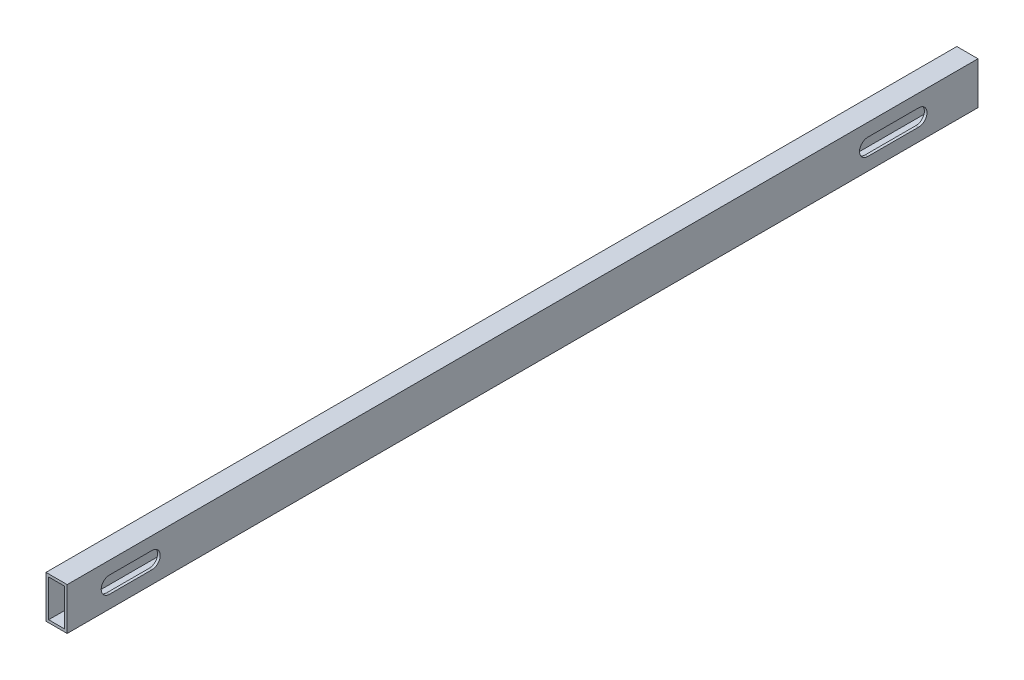
from build123d import *

# Parameters (mm, degrees)
SKETCH1_W           = 12.7
SKETCH1_H           = 25.4
SKETCH1_W_2         = 9.525
SKETCH1_H_2         = 22.225
BOSS_EXTRUDE1_DEPTH = 546.1
SKETCH2_R           = 3.81
SKETCH2_R_2         = 2.75
CUT_EXTRUDE1_DEPTH  = 547.395269013
CUT_EXTRUDE3_REACH  = 548.395
CUT_EXTRUDE5_REACH  = 548.727
SKETCH5_R           = 2.75


with BuildPart() as part:
    # Sketch1 → Boss-Extrude1 (new body)
    with BuildSketch(Plane.XY):
        Rectangle(SKETCH1_W, SKETCH1_H)
        Rectangle(SKETCH1_W_2, SKETCH1_H_2, mode=Mode.SUBTRACT)
    extrude(amount=BOSS_EXTRUDE1_DEPTH)

    # Sketch2 → Cut-Extrude1 (cut, through all)
    with BuildSketch(Plane(origin=(6.35, 0, 0), x_dir=(0, 0, -1), z_dir=(1, 0, 0))):
        with Locations((-508, 0)):
            Circle(SKETCH2_R)
        with Locations((-520.7, 0)):
            Circle(SKETCH2_R_2)
        with Locations((-495.3, 0)):
            Circle(SKETCH2_R_2)
        with BuildLine():
            Line((-44.45, -3.302), (-57.15, -3.302))
            ThreePointArc((-57.15, -3.302), (-60.452, 0), (-57.15, 3.302))
            Line((-57.15, 3.302), (-44.45, 3.302))
            ThreePointArc((-44.45, 3.302), (-41.148, 0), (-44.45, -3.302))
        make_face()
    extrude(amount=-CUT_EXTRUDE1_DEPTH, mode=Mode.SUBTRACT)

    # Sketch4 → Cut-Extrude3 (cut, up to next)
    with BuildSketch(Plane.ZY.offset(-6.35), mode=Mode.PRIVATE) as cut_extrude3_sk1:
        with BuildLine():
            Line((35.56, 5), (66.04, 5))
            ThreePointArc((66.04, 5), (71.04, 0), (66.04, -5))
            Line((66.04, -5), (35.56, -5))
            ThreePointArc((35.56, -5), (30.56, 0), (35.56, 5))
        make_face()
    cut_extrude3_tool1 = extrude(cut_extrude3_sk1.sketch, amount=CUT_EXTRUDE3_REACH, mode=Mode.PRIVATE) & part.part
    # Sketch4 → Cut-Extrude3 (cut, up to next)
    with BuildSketch(Plane.ZY.offset(-6.35), mode=Mode.PRIVATE) as cut_extrude3_sk2:
        with BuildLine():
            Line((495.3, 5), (520.7, 5))
            ThreePointArc((520.7, 5), (525.7, 0), (520.7, -5))
            Line((520.7, -5), (495.3, -5))
            ThreePointArc((495.3, -5), (490.3, 0), (495.3, 5))
        make_face()
    cut_extrude3_tool2 = extrude(cut_extrude3_sk2.sketch, amount=CUT_EXTRUDE3_REACH, mode=Mode.PRIVATE) & part.part
    add(cut_extrude3_tool1.solids().sort_by_distance((6.35, 0, 50.8))[0], mode=Mode.SUBTRACT)
    add(cut_extrude3_tool2.solids().sort_by_distance((6.35, 0, 508))[0], mode=Mode.SUBTRACT)

    # Sketch5 → Cut-Extrude5 (cut, up to next)
    with BuildSketch(Plane.XZ.offset(12.7), mode=Mode.PRIVATE) as cut_extrude5_sk1:
        with Locations(Location((0, 533.4, 0), (0, 0, 270))):
            Circle(SKETCH5_R)
    cut_extrude5_tool1 = extrude(cut_extrude5_sk1.sketch, amount=-CUT_EXTRUDE5_REACH, mode=Mode.PRIVATE) & part.part
    # Sketch5 → Cut-Extrude5 (cut, up to next)
    with BuildSketch(Plane.XZ.offset(12.7), mode=Mode.PRIVATE) as cut_extrude5_sk2:
        with Locations(Location((0, 12.7, 0), (0, 0, 270))):
            Circle(SKETCH5_R)
    cut_extrude5_tool2 = extrude(cut_extrude5_sk2.sketch, amount=-CUT_EXTRUDE5_REACH, mode=Mode.PRIVATE) & part.part
    add(cut_extrude5_tool1.solids().sort_by_distance((0, -12.7, 533.4))[0], mode=Mode.SUBTRACT)
    add(cut_extrude5_tool2.solids().sort_by_distance((0, -12.7, 12.7))[0], mode=Mode.SUBTRACT)


solid = part.part
